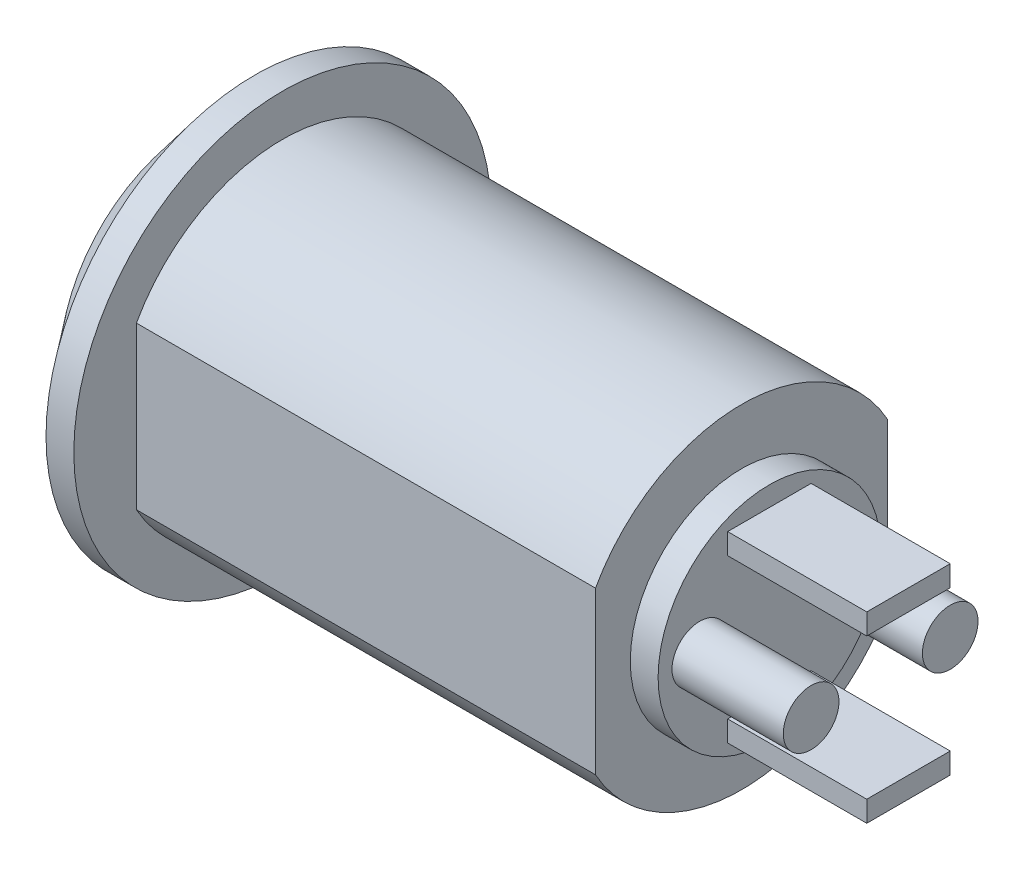
from build123d import *

# Parameters (mm, degrees)
SKETCH_2_W          = 2
SKETCH_2_H          = 6.5
CUT_EXTRUDE_1_DEPTH = 10
SKETCH_3_W          = 5.751946122
SKETCH_3_H          = 18.448834599
CUT_EXTRUDE_2_DEPTH = 17.5
SKETCH_4_W          = 3
SKETCH_4_H          = 0.75
EXTRUDE_944_DEPTH   = 5
SKETCH_5_R          = 1
EXTRUDE_1_DEPTH     = 4


with BuildPart() as part:
    # 草图1 → 旋转1 (revolve)
    with BuildSketch(Plane.XY, mode=Mode.PRIVATE) as revolve_1_sk:
        Polygon((0, 0), (0, 5), (2, 7.5), (3, 7.5), (3, 6), (19.5, 6), (19.5, 4), (20.5, 4), (20.5, 0), align=None)
    revolve(revolve_1_sk.sketch.rotate(Axis((0, 0, 0), (1, 0, 0)), 90), axis=Axis((0, 0, 0), (1, 0, 0)))

    # 草图2 → 切除-拉伸1 (cut)
    with BuildSketch(Plane(origin=(0, 0, 0), x_dir=(0, 0, -1), z_dir=(1, 0, 0))):
        Rectangle(SKETCH_2_W, SKETCH_2_H)
    extrude(amount=CUT_EXTRUDE_1_DEPTH, mode=Mode.SUBTRACT)

    # 草图3 → 切除-拉伸2 (cut)
    with BuildSketch(Plane(origin=(20.5, 0, 0), x_dir=(0, 0, -1), z_dir=(1, 0, 0))):
        with Locations((-8.125973061, 0.639105125)):
            Rectangle(SKETCH_3_W, SKETCH_3_H)
        with Locations((8.125973061, 0.639105125)):
            Rectangle(SKETCH_3_W, SKETCH_3_H)
    extrude(amount=-CUT_EXTRUDE_2_DEPTH, mode=Mode.SUBTRACT)

    # 草图4 → Extrude 944 (add)
    with BuildSketch(Plane(origin=(20.5, 0, 0), x_dir=(0, 0, -1), z_dir=(1, 0, 0))):
        with Locations((0, 2.915)):
            Rectangle(SKETCH_4_W, SKETCH_4_H)
        with Locations((0, -2.915)):
            Rectangle(SKETCH_4_W, SKETCH_4_H)
    extrude(amount=EXTRUDE_944_DEPTH)

    # 草图5 → 凸台-拉伸1 (add)
    with BuildSketch(Plane(origin=(20.5, 0, 0), x_dir=(0, 0, -1), z_dir=(1, 0, 0))):
        with Locations(Location((-2.5, 0, 0), (0, 0, 180))):
            Circle(SKETCH_5_R)
        with Locations(Location((2.5, 0, 0), (0, 0, 180))):
            Circle(SKETCH_5_R)
    extrude(amount=EXTRUDE_1_DEPTH)


solid = part.part
